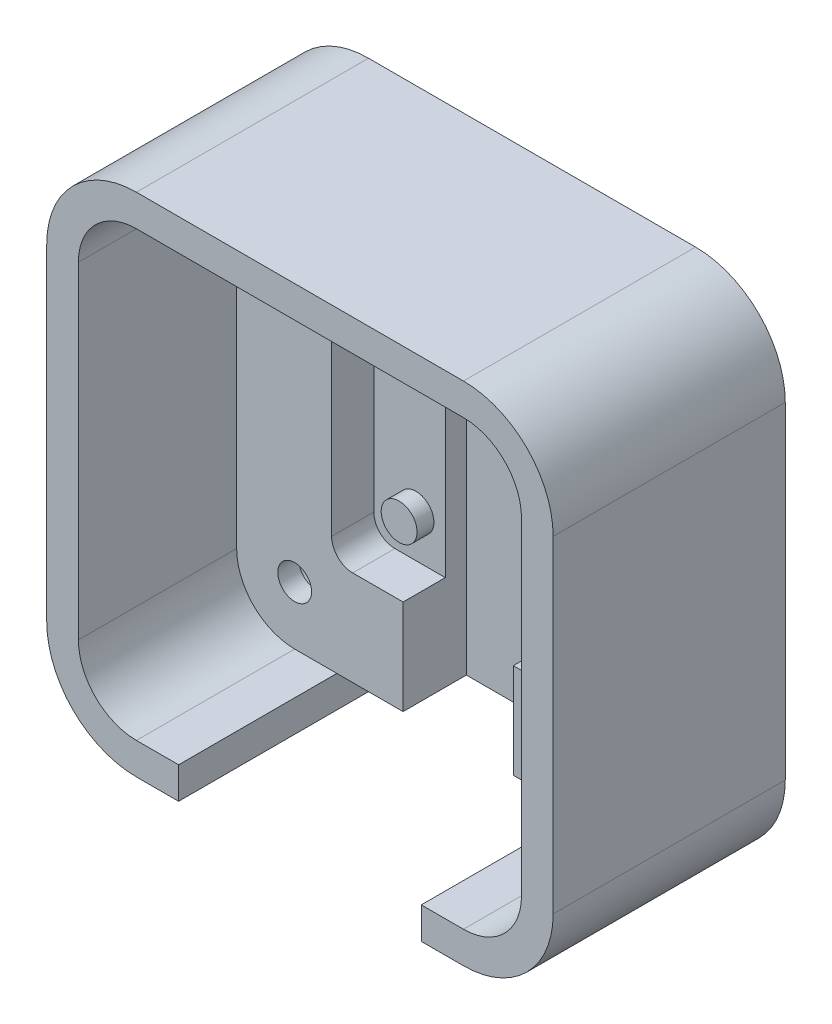
from build123d import *

# Parameters (mm, degrees)
RESSALTO_EXTRUS_O1_DEPTH = 7
CORTE_EXTRUS_O1_DEPTH    = 31.512292605
RESSALTO_EXTRUS_O2_DEPTH = 3
ESBO_O4_R                = 1.7
RESSALTO_EXTRUS_O3_DEPTH = 1.6
CORTE_EXTRUS_O2_REACH    = 49.476
ESBO_O5_W                = 10.45
ESBO_O5_H                = 6
ESBO_O6_W                = 10.45
ESBO_O6_H                = 24
RESSALTO_EXTRUS_O4_DEPTH = 1
CORTE_EXTRUS_O3_REACH    = 32.512
ESBO_O8_R                = 1.6
ESBO_O11_R               = 2.9
CORTE_EXTRUS_O4_DEPTH    = 5
RESSALTO_EXTRUS_O5_DEPTH = 22


with BuildPart() as part:
    # Esboço1 → Ressalto-extrusão1 (new body)
    with BuildSketch(Plane.XY):
        with BuildLine():
            Line((15.5, -21), (-15.5, -21))
            ThreePointArc((-15.5, -21), (-19.389087297, -19.389087297), (-21, -15.5))
            Line((-21, -15.5), (-21, 15.5))
            ThreePointArc((-21, 15.5), (-19.389087297, 19.389087297), (-15.5, 21))
            Line((-15.5, 21), (15.5, 21))
            ThreePointArc((15.5, 21), (19.389087297, 19.389087297), (21, 15.5))
            Line((21, 15.5), (21, -15.5))
            ThreePointArc((21, -15.5), (19.389087297, -19.389087297), (15.5, -21))
        make_face()
    extrude(amount=RESSALTO_EXTRUS_O1_DEPTH)

    # Esboço2 → Corte-extrusão1 (cut, through all)
    with BuildSketch(Plane(origin=(0, 0, 0), x_dir=(-1, 0, 0), z_dir=(0, 0, -1))):
        with BuildLine():
            Line((10, -12), (-10, -12))
            ThreePointArc((-10, -12), (-11.414213562, -11.414213562), (-12, -10))
            Line((-12, -10), (-12, 10))
            ThreePointArc((-12, 10), (-11.414213562, 11.414213562), (-10, 12))
            Line((-10, 12), (10, 12))
            ThreePointArc((10, 12), (11.414213562, 11.414213562), (12, 10))
            Line((12, 10), (12, -10))
            ThreePointArc((12, -10), (11.414213562, -11.414213562), (10, -12))
        make_face()
    extrude(amount=-CORTE_EXTRUS_O1_DEPTH, mode=Mode.SUBTRACT)

    # Esboço3 → Ressalto-extrusão2 (add)
    with BuildSketch(Plane(origin=(0, 0, 0), x_dir=(-1, 0, 0), z_dir=(0, 0, -1))):
        with BuildLine():
            Line((-5.225, 12), (-5.225, -12))
            Line((-5.225, -12), (-10, -12))
            ThreePointArc((-10, -12), (-11.414213562, -11.414213562), (-12, -10))
            Line((-12, -10), (-12, 10))
            ThreePointArc((-12, 10), (-11.414213562, 11.414213562), (-10, 12))
            Line((-10, 12), (-5.225, 12))
        make_face()
        with BuildLine():
            Line((5.225, 12), (10, 12))
            ThreePointArc((10, 12), (11.414213562, 11.414213562), (12, 10))
            Line((12, 10), (12, -10))
            ThreePointArc((12, -10), (11.414213562, -11.414213562), (10, -12))
            Line((10, -12), (5.225, -12))
            Line((5.225, -12), (5.225, 12))
        make_face()
    extrude(amount=-RESSALTO_EXTRUS_O2_DEPTH)

    # Esboço4 → Ressalto-extrusão3 (add)
    with BuildSketch(Plane.XY.offset(3)):
        with Locations((-8, 8)):
            Circle(ESBO_O4_R)
        with Locations(Location((8, 8, 0), (0, 0, 180))):
            Circle(ESBO_O4_R)
        with Locations(Location((8, -8, 0), (0, 0, 180))):
            Circle(ESBO_O4_R)
        with Locations((-8, -8)):
            Circle(ESBO_O4_R)
    extrude(amount=RESSALTO_EXTRUS_O3_DEPTH)

    # Esboço5 → Corte-extrusão2 (cut, up to next)
    with BuildSketch(Plane.XZ.offset(21), mode=Mode.PRIVATE) as corte_extrus_o2_sk1:
        with Locations((0, 4)):
            Rectangle(ESBO_O5_W, ESBO_O5_H)
    corte_extrus_o2_tool1 = extrude(corte_extrus_o2_sk1.sketch, amount=-CORTE_EXTRUS_O2_REACH, mode=Mode.PRIVATE) & part.part
    add(corte_extrus_o2_tool1.solids().sort_by_distance((0, -21, 4))[0], mode=Mode.SUBTRACT)

    # Esboço6 → Ressalto-extrusão4 (add)
    with BuildSketch(Plane(origin=(0, 0, 0), x_dir=(-1, 0, 0), z_dir=(0, 0, -1))):
        Rectangle(ESBO_O6_W, ESBO_O6_H)
    extrude(amount=-RESSALTO_EXTRUS_O4_DEPTH)

    # Esboço8 → Corte-extrusão3 (cut, up to next)
    with BuildSketch(Plane.XY.offset(7), mode=Mode.PRIVATE) as corte_extrus_o3_sk1:
        with Locations((-15.5, 15.5)):
            Circle(ESBO_O8_R)
    corte_extrus_o3_tool1 = extrude(corte_extrus_o3_sk1.sketch, amount=-CORTE_EXTRUS_O3_REACH, mode=Mode.PRIVATE) & part.part
    # Esboço8 → Corte-extrusão3 (cut, up to next)
    with BuildSketch(Plane.XY.offset(7), mode=Mode.PRIVATE) as corte_extrus_o3_sk2:
        with Locations(Location((15.5, 15.5, 0), (0, 0, 180))):
            Circle(ESBO_O8_R)
    corte_extrus_o3_tool2 = extrude(corte_extrus_o3_sk2.sketch, amount=-CORTE_EXTRUS_O3_REACH, mode=Mode.PRIVATE) & part.part
    # Esboço8 → Corte-extrusão3 (cut, up to next)
    with BuildSketch(Plane.XY.offset(7), mode=Mode.PRIVATE) as corte_extrus_o3_sk3:
        with Locations((15.5, -15.5)):
            Circle(ESBO_O8_R)
    corte_extrus_o3_tool3 = extrude(corte_extrus_o3_sk3.sketch, amount=-CORTE_EXTRUS_O3_REACH, mode=Mode.PRIVATE) & part.part
    # Esboço8 → Corte-extrusão3 (cut, up to next)
    with BuildSketch(Plane.XY.offset(7), mode=Mode.PRIVATE) as corte_extrus_o3_sk4:
        with Locations(Location((-15.5, -15.5, 0), (0, 0, 180))):
            Circle(ESBO_O8_R)
    corte_extrus_o3_tool4 = extrude(corte_extrus_o3_sk4.sketch, amount=-CORTE_EXTRUS_O3_REACH, mode=Mode.PRIVATE) & part.part
    add(corte_extrus_o3_tool1.solids().sort_by_distance((-15.5, 15.5, 7))[0], mode=Mode.SUBTRACT)
    add(corte_extrus_o3_tool2.solids().sort_by_distance((15.5, 15.5, 7))[0], mode=Mode.SUBTRACT)
    add(corte_extrus_o3_tool3.solids().sort_by_distance((15.5, -15.5, 7))[0], mode=Mode.SUBTRACT)
    add(corte_extrus_o3_tool4.solids().sort_by_distance((-15.5, -15.5, 7))[0], mode=Mode.SUBTRACT)

    # Esboço11 → Corte-extrusão4 (cut)
    with BuildSketch(Plane(origin=(0, 0, 0), x_dir=(-1, 0, 0), z_dir=(0, 0, -1))):
        with Locations((-15.5, 15.5)):
            Circle(ESBO_O11_R)
        with Locations(Location((15.5, 15.5, 0), (0, 0, 180))):
            Circle(ESBO_O11_R)
        with Locations((15.5, -15.5)):
            Circle(ESBO_O11_R)
        with Locations(Location((-15.5, -15.5, 0), (0, 0, 180))):
            Circle(ESBO_O11_R)
    extrude(amount=-CORTE_EXTRUS_O4_DEPTH, mode=Mode.SUBTRACT)

    # Esboço13 → Ressalto-extrusão5 (add)
    with BuildSketch(Plane(origin=(0, 0, 0), x_dir=(-1, 0, 0), z_dir=(0, 0, -1))):
        with BuildLine():
            Line((24, -15.5), (24, 15.5))
            ThreePointArc((24, 15.5), (21.51040764, 21.51040764), (15.5, 24))
            Line((15.5, 24), (-15.5, 24))
            ThreePointArc((-15.5, 24), (-21.51040764, 21.51040764), (-24, 15.5))
            Line((-24, 15.5), (-24, -15.5))
            ThreePointArc((-24, -15.5), (-21.51040764, -21.51040764), (-15.5, -24))
            Line((-15.5, -24), (-11.5, -24))
            Line((-11.5, -24), (-11.5, -21))
            Line((-11.5, -21), (-15.5, -21))
            ThreePointArc((-15.5, -21), (-19.389087297, -19.389087297), (-21, -15.5))
            Line((-21, -15.5), (-21, 15.5))
            ThreePointArc((-21, 15.5), (-19.389087297, 19.389087297), (-15.5, 21))
            Line((-15.5, 21), (15.5, 21))
            ThreePointArc((15.5, 21), (19.389087297, 19.389087297), (21, 15.5))
            Line((21, 15.5), (21, -15.5))
            ThreePointArc((21, -15.5), (19.389087297, -19.389087297), (15.5, -21))
            Line((15.5, -21), (11.5, -21))
            Line((11.5, -21), (11.5, -24))
            Line((11.5, -24), (15.5, -24))
            ThreePointArc((15.5, -24), (21.51040764, -21.51040764), (24, -15.5))
        make_face()
    extrude(amount=-RESSALTO_EXTRUS_O5_DEPTH)


solid = part.part
